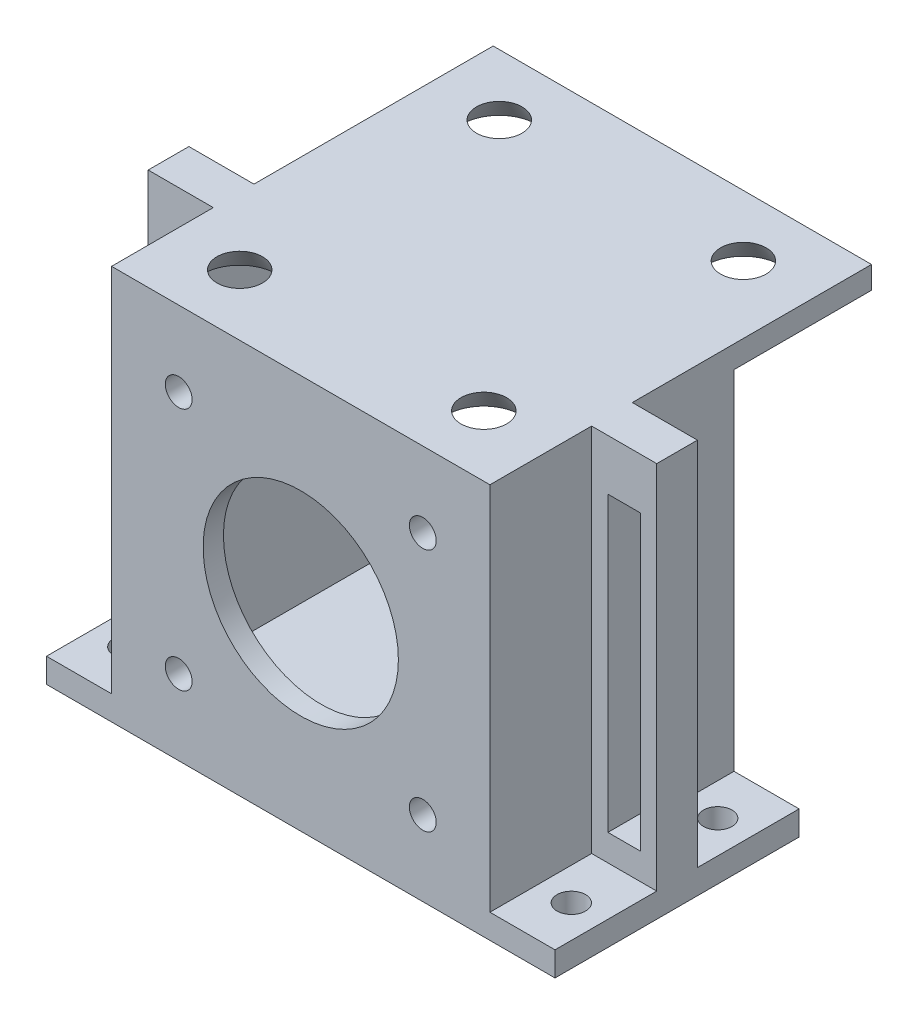
from build123d import *

# Parameters (mm, degrees)
SKETCH1_W           = 82
SKETCH1_H           = 30
SKETCH1_R           = 2
BOSS_EXTRUDE1_DEPTH = 3
BOSS_EXTRUDE2_DEPTH = 42.5
SKETCH4_R           = 12
SKETCH4_R_2         = 1.65
CUT_EXTRUDE2_DEPTH  = 99.459382488
SKETCH7_W           = 19.5
SKETCH7_H           = 30
CUT_EXTRUDE4_DEPTH  = 98.109474306
SKETCH8_W           = 8
SKETCH8_H           = 5
BOSS_EXTRUDE3_DEPTH = 42.5
SKETCH8_3_R         = 1.755
CUT_EXTRUDE5_DEPTH  = 82.317279836
SKETCH9_W           = 4
SKETCH9_H           = 36
CUT_EXTRUDE6_DEPTH  = 80.26380006
SKETCH10_W          = 46.5
SKETCH10_H          = 46.9
SKETCH10_R          = 4.75
BOSS_EXTRUDE4_DEPTH = 3
BOSS_EXTRUDE4_DRAFT = -33
SKETCH12_W          = 8
SKETCH12_H          = 5
BOSS_EXTRUDE6_DEPTH = 3
CUT_EXTRUDE7_DEPTH  = 3
CUT_EXTRUDE8_DEPTH  = 0.25


with BuildPart() as part:
    # Sketch1 → Boss-Extrude1 (new body)
    with BuildSketch(Plane(origin=(0, 0, 0), x_dir=(1, 0, 0), z_dir=(0, 1, 0))):
        with Locations((41, 15)):
            Rectangle(SKETCH1_W, SKETCH1_H)
        with Locations(Location((78, 23.86, 0), (0, 0, 270))):
            Circle(SKETCH1_R, mode=Mode.SUBTRACT)
        with Locations(Location((78, 5, 0), (0, 0, 270))):
            Circle(SKETCH1_R, mode=Mode.SUBTRACT)
    extrude(amount=BOSS_EXTRUDE1_DEPTH)

    # Sketch2 → Boss-Extrude2 (add)
    with BuildSketch(Plane(origin=(0, 3, 0), x_dir=(1, 0, 0), z_dir=(0, 1, 0))):
        Polygon((52.5, 2.5), (10, 2.5), (10, 30), (8, 30), (8, 0), (54.5, 0), (54.5, 30), (52.5, 30), align=None)
    extrude(amount=BOSS_EXTRUDE2_DEPTH)

    # Sketch4 → Cut-Extrude2 (cut, through all)
    with BuildSketch(Plane.XY):
        with Locations((31.25, 24.25)):
            Circle(SKETCH4_R)
        with Locations((16.25, 9.25)):
            Circle(SKETCH4_R_2)
        with Locations((16.25, 39.25)):
            Circle(SKETCH4_R_2)
        with Locations((46.25, 39.25)):
            Circle(SKETCH4_R_2)
        with Locations((46.25, 9.25)):
            Circle(SKETCH4_R_2)
    extrude(amount=-CUT_EXTRUDE2_DEPTH, mode=Mode.SUBTRACT)

    # Sketch7 → Cut-Extrude4 (cut, through all)
    with BuildSketch(Plane(origin=(0, 3, 0), x_dir=(1, 0, 0), z_dir=(0, 1, 0))):
        with Locations((72.25, 15)):
            Rectangle(SKETCH7_W, SKETCH7_H)
    extrude(amount=-CUT_EXTRUDE4_DEPTH, mode=Mode.SUBTRACT)

    # Sketch8 → Boss-Extrude3 (add)
    with BuildSketch(Plane(origin=(0, 3, 0), x_dir=(1, 0, 0), z_dir=(0, 1, 0))):
        with Locations((4, 15)):
            Rectangle(SKETCH8_W, SKETCH8_H)
        with Locations((58.5, 15)):
            Rectangle(SKETCH8_W, SKETCH8_H)
    extrude(amount=BOSS_EXTRUDE3_DEPTH)

    # Sketch8<3> → Cut-Extrude5 (cut, through all)
    with BuildSketch(Plane(origin=(0, 3, 0), x_dir=(1, 0, 0), z_dir=(0, 1, 0))):
        with Locations(Location((4, 24, 0), (0, 0, 270))):
            Circle(SKETCH8_3_R)
        with Locations(Location((4, 6, 0), (0, 0, 90))):
            Circle(SKETCH8_3_R)
        with Locations(Location((58.5, 6, 0), (0, 0, 270))):
            Circle(SKETCH8_3_R)
        with Locations(Location((58.5, 24, 0), (0, 0, 90))):
            Circle(SKETCH8_3_R)
    extrude(amount=-CUT_EXTRUDE5_DEPTH, mode=Mode.SUBTRACT)

    # Sketch9 → Cut-Extrude6 (cut, through all)
    with BuildSketch(Plane(origin=(0, 0, -17.5), x_dir=(-1, 0, 0), z_dir=(0, 0, -1))):
        with Locations((-58.5, 24.25)):
            Rectangle(SKETCH9_W, SKETCH9_H)
        with Locations((-4, 24.25)):
            Rectangle(SKETCH9_W, SKETCH9_H)
    extrude(amount=-CUT_EXTRUDE6_DEPTH, mode=Mode.SUBTRACT)


with BuildPart() as boss_extrude4_tool:
    # Sketch10 → Boss-Extrude4 (with draft: the straight prism first)
    with BuildSketch(Plane(origin=(0, 45.5, 0), x_dir=(1, 0, 0), z_dir=(0, 1, 0))):
        with Locations((31.25, 23.45)):
            Rectangle(SKETCH10_W, SKETCH10_H)
        with Locations((16.25, 7.5)):
            Circle(SKETCH10_R, mode=Mode.SUBTRACT)
        with Locations((46.25, 7.5)):
            Circle(SKETCH10_R, mode=Mode.SUBTRACT)
        with Locations((46.25, 39.4)):
            Circle(SKETCH10_R, mode=Mode.SUBTRACT)
        with Locations((16.25, 39.4)):
            Circle(SKETCH10_R, mode=Mode.SUBTRACT)
    extrude(amount=BOSS_EXTRUDE4_DEPTH)
    # Boss-Extrude4: the draft: its side faces are tilted about the plane it starts from
    boss_extrude4_sides = [boss_extrude4_tool.faces().sort_by_distance(p)[0] for p in [
        (31.25, 47, 0),
        (54.5, 47, -23.45),
        (31.25, 47, -46.9),
        (8, 47, -23.45),
        (11.5, 47, -7.5),
        (41.5, 47, -7.5),
        (41.5, 47, -39.4),
        (11.5, 47, -39.4),
    ]]
    draft(boss_extrude4_sides, Plane(origin=(0, 45.5, 0), x_dir=(1, 0, 0), z_dir=(0, 1, 0)), BOSS_EXTRUDE4_DRAFT)


with BuildPart() as part_1:
    add(part.part)

    # Boss-Extrude4: add boss_extrude4_tool
    add(boss_extrude4_tool.part)

    # Sketch12 → Boss-Extrude6 (add)
    with BuildSketch(Plane(origin=(0, 45.5, 0), x_dir=(1, 0, 0), z_dir=(0, 1, 0))):
        with Locations((4, 15)):
            Rectangle(SKETCH12_W, SKETCH12_H)
        with Locations((58.5, 15)):
            Rectangle(SKETCH12_W, SKETCH12_H)
    extrude(amount=BOSS_EXTRUDE6_DEPTH)

    # Sketch13 → Cut-Extrude7 (cut)
    with BuildSketch(Plane(origin=(0, 48.5, 0), x_dir=(1, 0, 0), z_dir=(0, 1, 0))):
        Polygon((56.44822278, 17.5), (54.5, 17.5), (54.5, 30), (54.5, 46.9), (8, 46.9), (8, 30), (8, 17.5), (6.05177722, 17.5), (6.05177722, 48.84822278), (56.44822278, 48.84822278), align=None)
        Polygon((54.5, 12.5), (56.44822278, 12.5), (56.44822278, -1.94822278), (6.05177722, -1.94822278), (6.05177722, 12.5), (8, 12.5), (8, 0), (54.5, 0), align=None)
    extrude(amount=-CUT_EXTRUDE7_DEPTH, mode=Mode.SUBTRACT)

    # Sketch15 → Cut-Extrude8 (cut)
    with BuildSketch(Plane.XZ.offset(-45.5)):
        Polygon((10, -2.5), (10, -30), (8, -30), (8, -46.9), (54.5, -46.9), (54.5, -30), (52.5, -30), (52.5, -2.5), align=None)
    extrude(amount=-CUT_EXTRUDE8_DEPTH, mode=Mode.SUBTRACT)


solid = part_1.part
